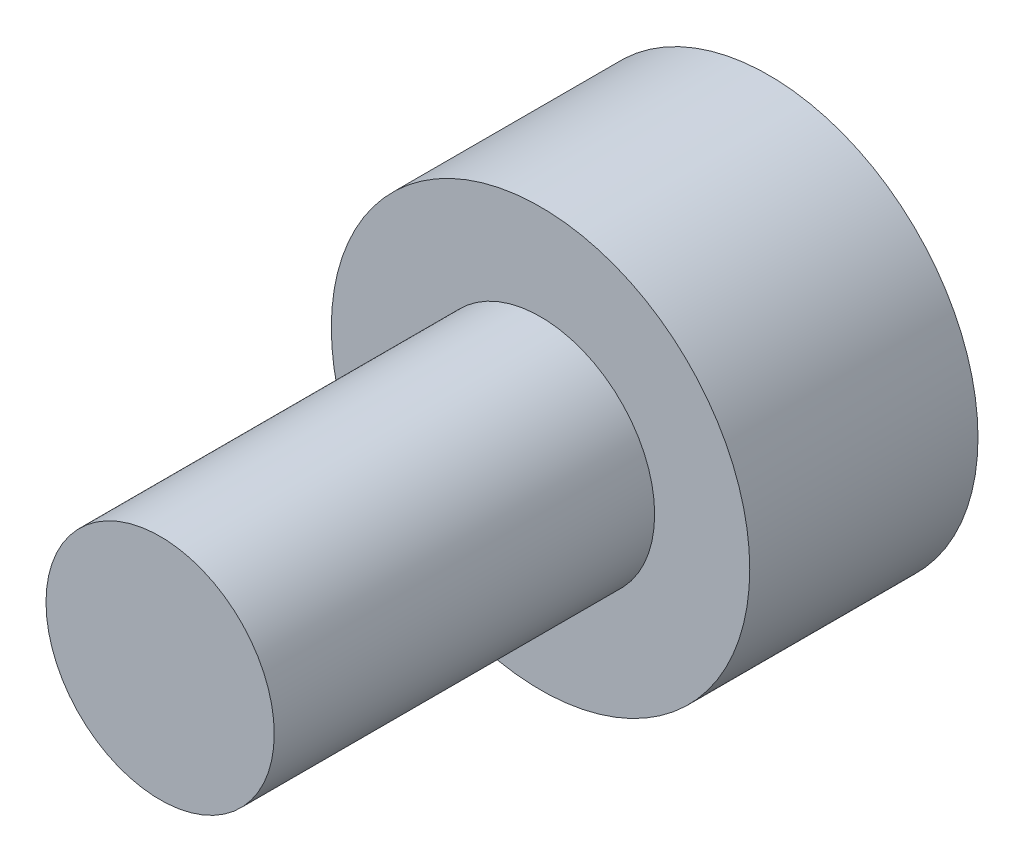
from build123d import *

# Parameters (mm, degrees)
SKETCH1_R          = 1.5
EXTRUDE1_DEPTH     = 5
SKETCH6_R          = 2.75
EXTRUDE2_DEPTH     = 3
CUT_EXTRUDE1_DEPTH = 1.875


with BuildPart() as part:
    # Sketch1 → Extrude1 (new body)
    with BuildSketch(Plane.XY):
        Circle(SKETCH1_R)
    extrude(amount=-EXTRUDE1_DEPTH)

    # Sketch6 → Extrude2 (add)
    with BuildSketch(Plane(origin=(0, 0, -5), x_dir=(-1, 0, 0), z_dir=(0, 0, -1))):
        Circle(SKETCH6_R)
    extrude(amount=EXTRUDE2_DEPTH)

    # Sketch7 → Cut-Extrude1 (cut)
    with BuildSketch(Plane(origin=(0, 0, -8), x_dir=(-1, 0, 0), z_dir=(0, 0, -1))):
        Polygon((0, 1.443375673), (-1.25, 0.721687836), (-1.25, -0.721687836), (0, -1.443375673), (1.25, -0.721687836), (1.25, 0.721687836), align=None)
    extrude(amount=-CUT_EXTRUDE1_DEPTH, mode=Mode.SUBTRACT)


solid = part.part
